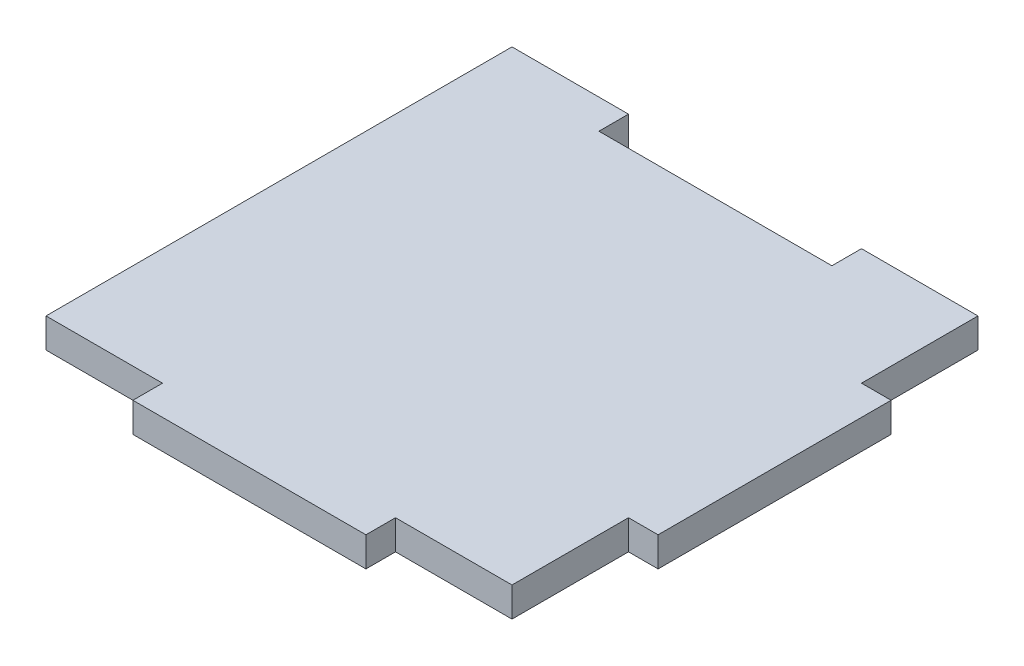
from build123d import *

# Parameters (mm, degrees)
SKETCH1_W           = 50
SKETCH1_H           = 50
BOSS_EXTRUDE1_DEPTH = 3.175
SKETCH3_W           = 3.175
SKETCH3_H           = 25
SKETCH3_W_2         = 25
SKETCH3_H_2         = 3.175
BOSS_EXTRUDE3_DEPTH = 3.175
SKETCH4_W           = 25
SKETCH4_H           = 3.175
CUT_EXTRUDE1_DEPTH  = 3.175


with BuildPart() as part:
    # Sketch1 → Boss-Extrude1 (new body)
    with BuildSketch(Plane(origin=(0, 0, 0), x_dir=(1, 0, 0), z_dir=(0, 1, 0))):
        Rectangle(SKETCH1_W, SKETCH1_H)
    extrude(amount=BOSS_EXTRUDE1_DEPTH)

    # Sketch3 → Boss-Extrude3 (add)
    with BuildSketch(Plane(origin=(0, 3.175, 0), x_dir=(1, 0, 0), z_dir=(0, 1, 0))):
        with Locations((26.5875, 0)):
            Rectangle(SKETCH3_W, SKETCH3_H)
        with Locations((0, -26.5875)):
            Rectangle(SKETCH3_W_2, SKETCH3_H_2)
    extrude(amount=-BOSS_EXTRUDE3_DEPTH)

    # Sketch4 → Cut-Extrude1 (cut)
    with BuildSketch(Plane(origin=(0, 3.175, 0), x_dir=(1, 0, 0), z_dir=(0, 1, 0))):
        with Locations((0, 23.4125)):
            Rectangle(SKETCH4_W, SKETCH4_H)
    extrude(amount=-CUT_EXTRUDE1_DEPTH, mode=Mode.SUBTRACT)


solid = part.part
